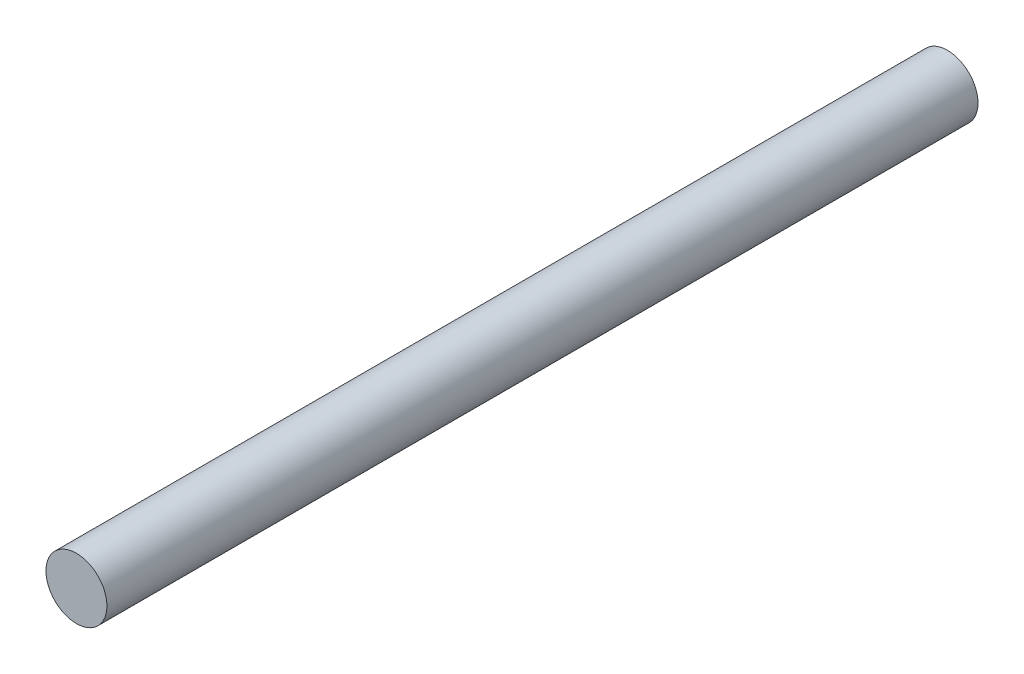
from build123d import *

# Parameters (mm, degrees)
SKETCH1_R           = 9.779
BOSS_EXTRUDE1_DEPTH = 279.4


with BuildPart() as part:
    # Sketch1 → Boss-Extrude1 (new body)
    with BuildSketch(Plane.XY):
        Circle(SKETCH1_R)
    extrude(amount=BOSS_EXTRUDE1_DEPTH)


solid = part.part
